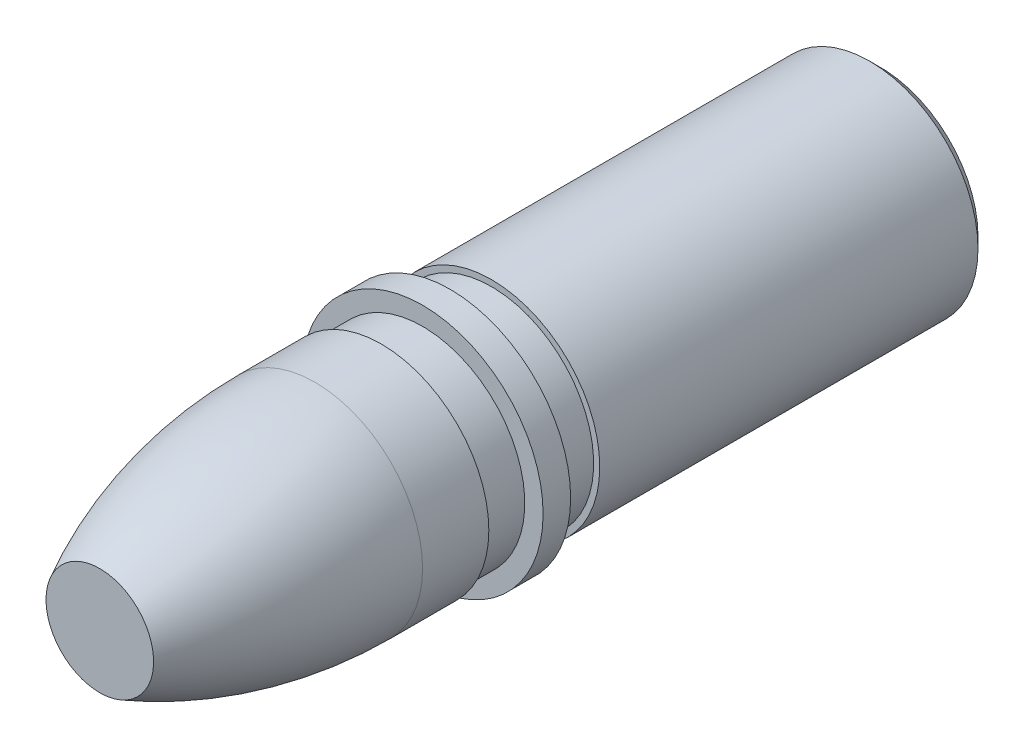
from build123d import *

# Parameters (mm, degrees)
CHAMFER1_SIZE = 0.319532


with BuildPart() as part:
    # Sketch2 → Revolve1 (revolve)
    with BuildSketch(Plane(origin=(0, 0, 0), x_dir=(0, 0, -1), z_dir=(1, 0, 0)), mode=Mode.PRIVATE) as revolve1_sk:
        with BuildLine():
            Line((0, 0), (0, 1.5875))
            ThreePointArc((0, 1.5875), (3.077438862, 2.771171998), (6.35, 3.17373))
            Line((6.35, 3.17373), (8.3058, 3.17373))
            Line((8.3058, 3.17373), (8.3058, 3.0150435))
            Line((8.3058, 3.0150435), (9.525, 3.0150435))
            Line((9.525, 3.0150435), (9.525, 3.556))
            Line((9.525, 3.556), (10.3378, 3.556))
            Line((10.3378, 3.556), (10.3378, 3.0150435))
            Line((10.3378, 3.0150435), (11.557, 3.0150435))
            Line((11.557, 3.0150435), (11.557, 3.19532))
            Line((11.557, 3.19532), (23.0378, 3.19532))
            Line((23.0378, 3.19532), (23.0378, 0))
            Line((23.0378, 0), (0, 0))
        make_face()
    revolve(revolve1_sk.sketch.rotate(Axis((0, 0, 0), (0, 0, 1)), 90), axis=Axis((0, 0, 0), (0, 0, 1)))

    # Chamfer1
    chamfer1_edges = [part.edges().sort_by_distance(p)[0] for p in [
        (3.19532, 0, -23.0378),
    ]]
    chamfer(chamfer1_edges, length=CHAMFER1_SIZE)


solid = part.part
